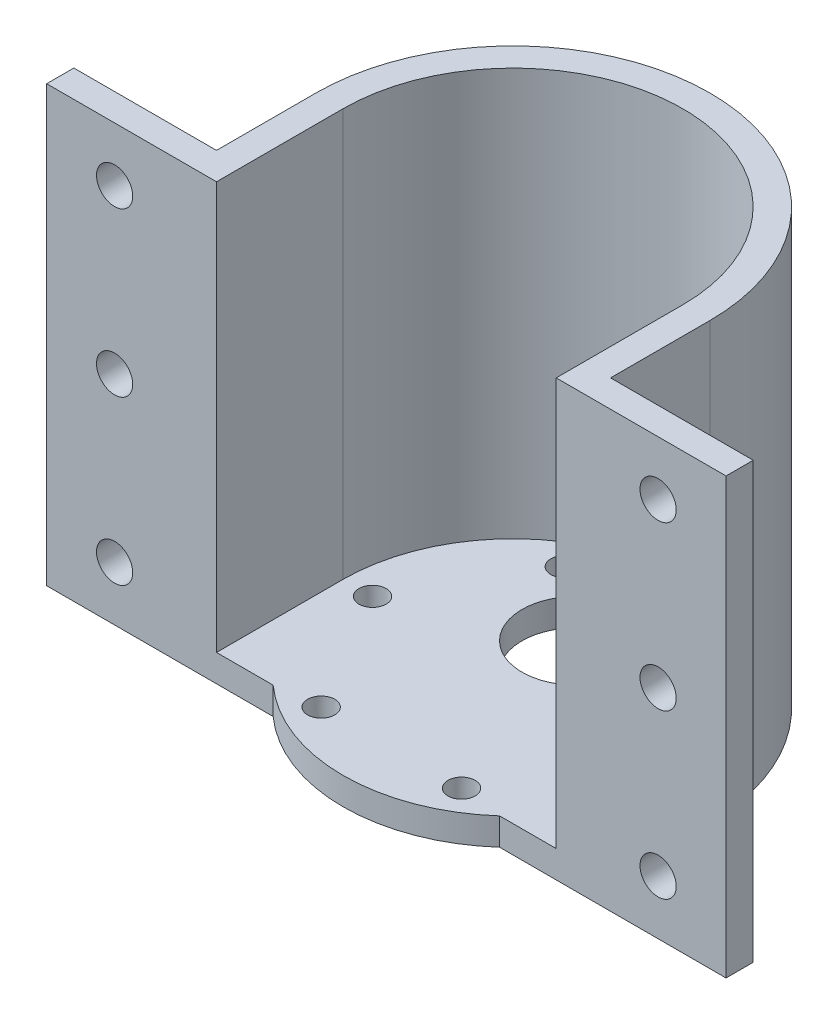
from build123d import *

# Parameters (mm, degrees)
BOSS_EXTRUDE1_DEPTH     = 48
CUT_EXTRUDE1_DEPTH      = 71.615550563
CUT_EXTRUDE1_DEPTH_BACK = 45
SKETCH3_R               = 6
SKETCH3_R_2             = 1.5
CUT_EXTRUDE2_DEPTH      = 71.615550563
SKETCH4_R               = 2
CUT_EXTRUDE3_DEPTH      = 70.146246697


with BuildPart() as part:
    # Sketch1 → Boss-Extrude1 (new body)
    with BuildSketch(Plane(origin=(0, 0, 0), x_dir=(1, 0, 0), z_dir=(0, 1, 0))):
        with BuildLine():
            Line((37.5, 0), (12.5, 0))
            ThreePointArc((12.5, 0), (0, -4.774575141), (-12.5, 0))
            Line((-12.5, 0), (-37.5, 0))
            Line((-37.5, 0), (-37.5, 3))
            Line((-37.5, 3), (-21.75, 3))
            Line((-21.75, 3), (-21.75, 13.975424859))
            ThreePointArc((-21.75, 13.975424859), (0, 35.725424859), (21.75, 13.975424859))
            Line((21.75, 13.975424859), (21.75, 3))
            Line((21.75, 3), (37.5, 3))
            Line((37.5, 3), (37.5, 0))
        make_face()
    extrude(amount=BOSS_EXTRUDE1_DEPTH)

    # Sketch2 → Cut-Extrude1 (cut, two sides: drawn at the far end of the back side and taken through both)
    with BuildSketch(Plane(origin=(0, 48, 0), x_dir=(1, 0, 0), z_dir=(0, 1, 0)).offset(-CUT_EXTRUDE1_DEPTH_BACK)):
        with BuildLine():
            Line((18.75, -143.272179863), (18.75, 0))
            Line((18.75, 0), (18.75, 13.975424859))
            ThreePointArc((18.75, 13.975424859), (0, 32.725424859), (-18.75, 13.975424859))
            Line((-18.75, 13.975424859), (-18.75, 0))
            Line((-18.75, 0), (-18.75, -143.272179863))
            Line((-18.75, -143.272179863), (-18.75, -429.81653959))
            Line((-18.75, -429.81653959), (18.75, -429.81653959))
            Line((18.75, -429.81653959), (18.75, -143.272179863))
        make_face()
    extrude(amount=CUT_EXTRUDE1_DEPTH + CUT_EXTRUDE1_DEPTH_BACK, mode=Mode.SUBTRACT)

    # Sketch3 → Cut-Extrude2 (cut, through all)
    with BuildSketch(Plane.XZ):
        with Locations(Location((0, -20.975424859, 0), (0, 0, 270))):
            Circle(SKETCH3_R)
        with Locations(Location((15.5, -13.975424859, 0), (0, 0, 270))):
            Circle(SKETCH3_R_2)
        with Locations(Location((7.75, -27.398818618, 0), (0, 0, 270))):
            Circle(SKETCH3_R_2)
        with Locations(Location((-7.75, -27.398818618, 0), (0, 0, 270))):
            Circle(SKETCH3_R_2)
        with Locations(Location((-15.5, -13.975424859, 0), (0, 0, 270))):
            Circle(SKETCH3_R_2)
        with Locations(Location((-7.75, -0.552031101, 0), (0, 0, 270))):
            Circle(SKETCH3_R_2)
        with Locations(Location((7.75, -0.552031101, 0), (0, 0, 270))):
            Circle(SKETCH3_R_2)
    extrude(amount=-CUT_EXTRUDE2_DEPTH, mode=Mode.SUBTRACT)

    # Sketch4 → Cut-Extrude3 (cut, through all)
    with BuildSketch(Plane(origin=(0, 0, -3), x_dir=(-1, 0, 0), z_dir=(0, 0, -1))):
        with Locations((-30, 6)):
            Circle(SKETCH4_R)
        with Locations((-30, 24)):
            Circle(SKETCH4_R)
        with Locations((-30, 42)):
            Circle(SKETCH4_R)
        with Locations((30, 6)):
            Circle(SKETCH4_R)
        with Locations((30, 24)):
            Circle(SKETCH4_R)
        with Locations((30, 42)):
            Circle(SKETCH4_R)
    extrude(amount=-CUT_EXTRUDE3_DEPTH, mode=Mode.SUBTRACT)


solid = part.part
